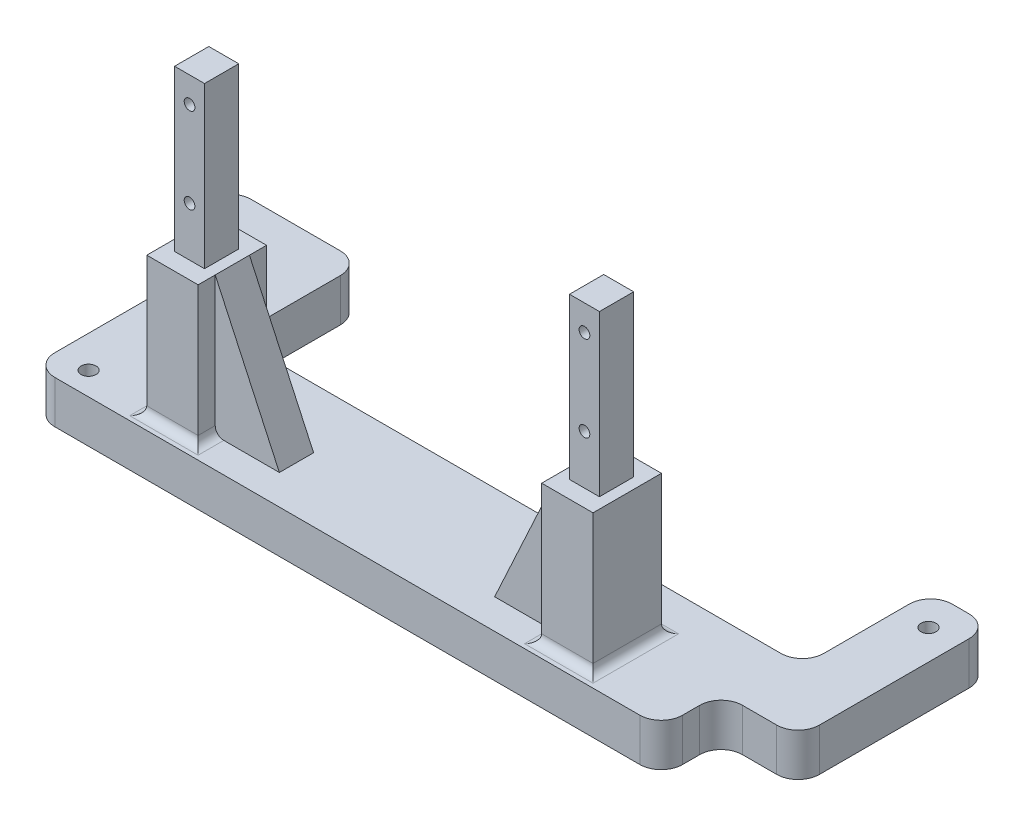
from build123d import *

# Parameters (mm, degrees)
SKETCH1_R           = 1.75
BOSS_EXTRUDE1_DEPTH = 10
SKETCH3_W           = 7
SKETCH3_H           = 8
BOSS_EXTRUDE3_DEPTH = 70
CUT_EXTRUDE1_REACH  = 183.843
SKETCH4_R           = 1.25
SKETCH5_W           = 12
SKETCH5_H           = 16
BOSS_EXTRUDE4_DEPTH = 32.5
FILLET4_R           = 2
RIB1_REACH          = 184.852
SKETCH6_WALL_W      = 403.497752534
SKETCH6_WALL_H      = 8


with BuildPart() as part:
    # Sketch1 → Boss-Extrude1 (new body)
    with BuildSketch(Plane(origin=(0, 0, 0), x_dir=(1, 0, 0), z_dir=(0, 1, 0))):
        with BuildLine():
            Line((-7.5, -0.4), (-7.5, 38.6))
            Line((-7.5, 38.6), (-15.61, 38.6))
            ThreePointArc((-15.61, 38.6), (-19.145533906, 40.064466094), (-20.61, 43.6))
            Line((-20.61, 43.6), (-20.61, 48.6))
            ThreePointArc((-20.61, 48.6), (-19.145533906, 52.135533906), (-15.61, 53.6))
            Line((-15.61, 53.6), (5.26, 53.6))
            ThreePointArc((5.26, 53.6), (8.795533906, 52.135533906), (10.26, 48.6))
            Line((10.26, 48.6), (10.26, 28.6))
            ThreePointArc((10.26, 28.6), (11.724466094, 25.064466094), (15.26, 23.6))
            Line((15.26, 23.6), (138.26, 23.6))
            ThreePointArc((138.26, 23.6), (141.795533906, 25.064466094), (143.26, 28.6))
            Line((143.26, 28.6), (143.26, 48.6))
            ThreePointArc((143.26, 48.6), (144.724466094, 52.135533906), (148.26, 53.6))
            Line((148.26, 53.6), (152.26, 53.6))
            ThreePointArc((152.26, 53.6), (155.795533906, 52.135533906), (157.26, 48.6))
            Line((157.26, 48.6), (157.26, 13.6))
            ThreePointArc((157.26, 13.6), (155.795533906, 10.064466094), (152.26, 8.6))
            Line((152.26, 8.6), (144.26, 8.6))
            ThreePointArc((144.26, 8.6), (140.724466094, 7.135533906), (139.26, 3.6))
            Line((139.26, 3.6), (139.26, -0.4))
            ThreePointArc((139.26, -0.4), (137.795533906, -3.935533906), (134.26, -5.4))
            Line((134.26, -5.4), (-2.5, -5.4))
            ThreePointArc((-2.5, -5.4), (-6.035533906, -3.935533906), (-7.5, -0.4))
        make_face()
        with Locations(Location((0, 0, 0), (0, 0, 270))):
            Circle(SKETCH1_R, mode=Mode.SUBTRACT)
        with Locations(Location((-14.61, 46.1, 0), (0, 0, 270))):
            Circle(SKETCH1_R, mode=Mode.SUBTRACT)
        with Locations(Location((150.26, 46.1, 0), (0, 0, 270))):
            Circle(SKETCH1_R, mode=Mode.SUBTRACT)
    extrude(amount=BOSS_EXTRUDE1_DEPTH)

    # Sketch3 → Boss-Extrude3 (add)
    with BuildSketch(Plane(origin=(0, 10, 0), x_dir=(1, 0, 0), z_dir=(0, 1, 0))):
        with Locations((22, 5.6)):
            Rectangle(SKETCH3_W, SKETCH3_H)
        with Locations((114.32, 5.6)):
            Rectangle(SKETCH3_W, SKETCH3_H)
    extrude(amount=BOSS_EXTRUDE3_DEPTH)

    # Sketch4 → Cut-Extrude1 (cut, up to next)
    with BuildSketch(Plane(origin=(0, 0, -9.6), x_dir=(-1, 0, 0), z_dir=(0, 0, -1)), mode=Mode.PRIVATE) as cut_extrude1_sk1:
        with Locations((-22, 74)):
            Circle(SKETCH4_R)
    cut_extrude1_tool1 = extrude(cut_extrude1_sk1.sketch, amount=-CUT_EXTRUDE1_REACH, mode=Mode.PRIVATE) & part.part
    # Sketch4 → Cut-Extrude1 (cut, up to next)
    with BuildSketch(Plane(origin=(0, 0, -9.6), x_dir=(-1, 0, 0), z_dir=(0, 0, -1)), mode=Mode.PRIVATE) as cut_extrude1_sk2:
        with Locations((-22, 54)):
            Circle(SKETCH4_R)
    cut_extrude1_tool2 = extrude(cut_extrude1_sk2.sketch, amount=-CUT_EXTRUDE1_REACH, mode=Mode.PRIVATE) & part.part
    # Sketch4 → Cut-Extrude1 (cut, up to next)
    with BuildSketch(Plane(origin=(0, 0, -9.6), x_dir=(-1, 0, 0), z_dir=(0, 0, -1)), mode=Mode.PRIVATE) as cut_extrude1_sk3:
        with Locations((-114.32, 54)):
            Circle(SKETCH4_R)
    cut_extrude1_tool3 = extrude(cut_extrude1_sk3.sketch, amount=-CUT_EXTRUDE1_REACH, mode=Mode.PRIVATE) & part.part
    # Sketch4 → Cut-Extrude1 (cut, up to next)
    with BuildSketch(Plane(origin=(0, 0, -9.6), x_dir=(-1, 0, 0), z_dir=(0, 0, -1)), mode=Mode.PRIVATE) as cut_extrude1_sk4:
        with Locations((-114.32, 74)):
            Circle(SKETCH4_R)
    cut_extrude1_tool4 = extrude(cut_extrude1_sk4.sketch, amount=-CUT_EXTRUDE1_REACH, mode=Mode.PRIVATE) & part.part
    add(cut_extrude1_tool1.solids().sort_by_distance((22, 74, -9.6))[0], mode=Mode.SUBTRACT)
    add(cut_extrude1_tool2.solids().sort_by_distance((22, 54, -9.6))[0], mode=Mode.SUBTRACT)
    add(cut_extrude1_tool3.solids().sort_by_distance((114.32, 54, -9.6))[0], mode=Mode.SUBTRACT)
    add(cut_extrude1_tool4.solids().sort_by_distance((114.32, 74, -9.6))[0], mode=Mode.SUBTRACT)

    # Sketch5 → Boss-Extrude4 (add)
    with BuildSketch(Plane(origin=(0, 10, 0), x_dir=(1, 0, 0), z_dir=(0, 1, 0))):
        with Locations((22, 5.6)):
            Rectangle(SKETCH5_W, SKETCH5_H)
        with Locations((114.32, 5.6)):
            Rectangle(SKETCH5_W, SKETCH5_H)
    extrude(amount=BOSS_EXTRUDE4_DEPTH)

    # Fillet4
    fillet4_edges = [part.edges().sort_by_distance(p)[0] for p in [
        (16, 10, -5.6),
        (22, 10, 2.4),
        (28, 10, -5.6),
        (22, 10, -13.6),
        (108.32, 10, -5.6),
        (114.32, 10, 2.4),
        (120.32, 10, -5.6),
        (114.32, 10, -13.6),
    ]]
    fillet(fillet4_edges, radius=FILLET4_R)

    # Sketch6 wall → Rib1 (add, up to next)
    with BuildSketch(Plane(origin=(100.82, 26.25, -5.6), x_dir=(-0.419058177462, -0.9079593845, 0), z_dir=(-0.9079593845, 0.419058177462, 0)), mode=Mode.PRIVATE) as rib1_sk1:
        Rectangle(SKETCH6_WALL_W, SKETCH6_WALL_H)
    rib1_tool1 = extrude(rib1_sk1.sketch, amount=-RIB1_REACH, mode=Mode.PRIVATE) - part.part
    rib1 = rib1_tool1.solids().sort_by_distance((100.82, 26.25, -5.6))[0]
    add(rib1)

    # Mirror1: Rib1 across plane
    add(rib1.mirror(Plane(origin=(68.16, 0, 0), x_dir=(0, 0, 1), z_dir=(1, 0, 0))))


solid = part.part
